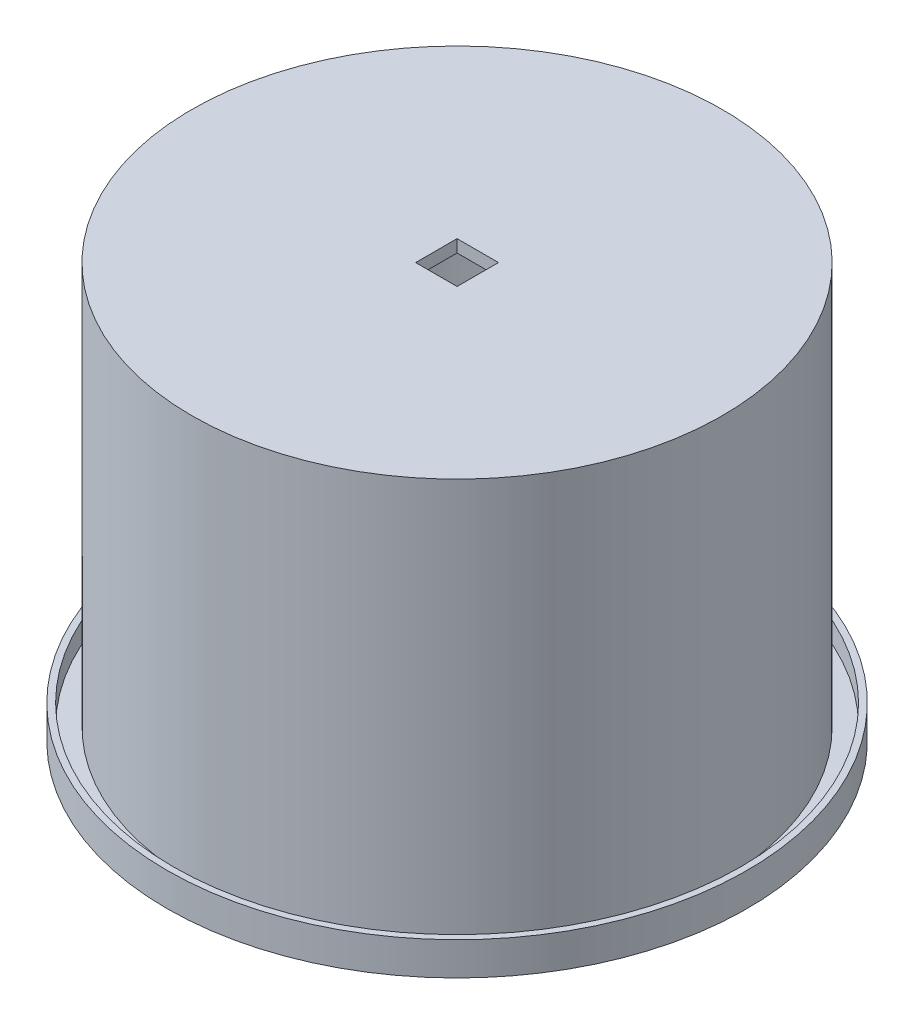
from build123d import *

# Parameters (mm, degrees)
SKETCH_1_R          = 70
SKETCH_1_R_2        = 68.5
EXTRUDE_1_DEPTH     = 8
SKETCH_2_R          = 68.5
SKETCH_2_R_2        = 64
EXTRUDE_2_DEPTH     = 3
SKETCH_3_R          = 64
SKETCH_3_R_2        = 62.5
EXTRUDE_3_DEPTH     = 100
EXTRUDE_START       = 97
SKETCH_4_R          = 62.5
EXTRUDE_4_DEPTH     = 3
SKETCH_5_W          = 10
SKETCH_5_H          = 10
CUT_EXTRUDE_1_DEPTH = 10


with BuildPart() as part:
    # 스케치1 → 보스-돌출1 (new body)
    with BuildSketch(Plane(origin=(0, 0, 0), x_dir=(1, 0, 0), z_dir=(0, 1, 0))):
        with Locations(Location((0, 0, 0), (0, 0, 270))):
            Circle(SKETCH_1_R)
        with Locations(Location((0, 0, 0), (0, 0, 270))):
            Circle(SKETCH_1_R_2, mode=Mode.SUBTRACT)
    extrude(amount=EXTRUDE_1_DEPTH)

    # 스케치2 → 보스-돌출2 (add)
    with BuildSketch(Plane(origin=(0, 0, 0), x_dir=(1, 0, 0), z_dir=(0, 1, 0))):
        with Locations(Location((0, 0, 0), (0, 0, 270))):
            Circle(SKETCH_2_R)
        with Locations(Location((0, 0, 0), (0, 0, 270))):
            Circle(SKETCH_2_R_2, mode=Mode.SUBTRACT)
    extrude(amount=EXTRUDE_2_DEPTH)

    # 스케치3 → 보스-돌출3 (add)
    with BuildSketch(Plane(origin=(0, 0, 0), x_dir=(1, 0, 0), z_dir=(0, 1, 0))):
        with Locations(Location((0, 0, 0), (0, 0, 270))):
            Circle(SKETCH_3_R)
        with Locations(Location((0, 0, 0), (0, 0, 270))):
            Circle(SKETCH_3_R_2, mode=Mode.SUBTRACT)
    extrude(amount=EXTRUDE_3_DEPTH)

    # 스케치4 → 보스-돌출4 (add)
    with BuildSketch(Plane(origin=(0, 0, 0), x_dir=(1, 0, 0), z_dir=(0, 1, 0)).offset(EXTRUDE_START)):
        with Locations(Location((0, 0, 0), (0, 0, 270))):
            Circle(SKETCH_4_R)
    extrude(amount=EXTRUDE_4_DEPTH)

    # 스케치5 → 컷-돌출1 (cut)
    with BuildSketch(Plane(origin=(0, 100, 0), x_dir=(1, 0, 0), z_dir=(0, 1, 0))):
        Rectangle(SKETCH_5_W, SKETCH_5_H)
    extrude(amount=-CUT_EXTRUDE_1_DEPTH, mode=Mode.SUBTRACT)


solid = part.part
